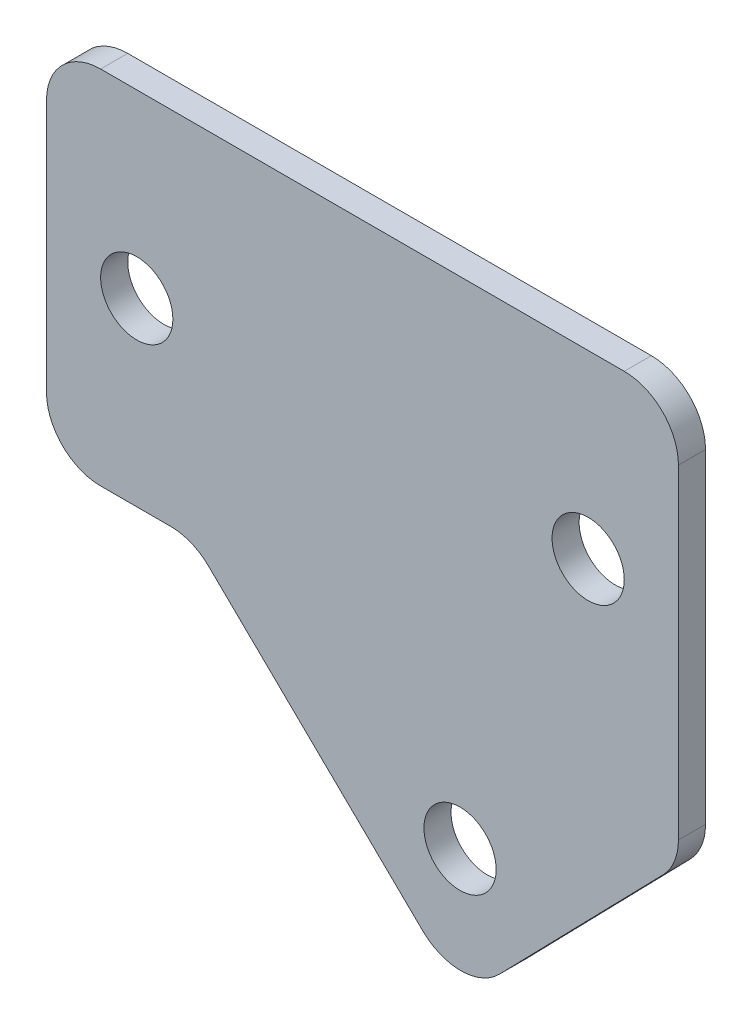
from build123d import *

# Parameters (mm, degrees)
SKETCH_1_R      = 2
EXTRUDE_1_DEPTH = 1.5
FILLET_1_R      = 3


with BuildPart() as part:
    # ｽｹｯﾁ1 → ﾎﾞｽ - 押し出し1 (new body)
    # profile 1 of 2: a face of its own
    with BuildSketch(Plane.XY):
        Polygon((-9.402488121, -2.740817625), (5.495827016, -17.259182375), (17.5, -4.940856231), (17.5, 17.259182375), (-17.5, 17.259182375), (-17.5, 5.150184139), align=None)
        with Locations((5.404503628, -10.188704312)):
            Circle(SKETCH_1_R, mode=Mode.SUBTRACT)
        with Locations((-12.5, 7.259182375)):
            Circle(SKETCH_1_R, mode=Mode.SUBTRACT)
        with Locations((12.5, 7.259182375)):
            Circle(SKETCH_1_R, mode=Mode.SUBTRACT)
    # profile 2 of 2: a face of its own
    with BuildSketch(Plane.XY):
        Polygon((-17.5, 5.150184139), (-17.5, -2.740817625), (-9.402488121, -2.740817625), align=None)
    extrude(amount=EXTRUDE_1_DEPTH)

    # ﾌｨﾚｯﾄ1
    fillet_1_edges = [part.edges().sort_by_distance(p)[0] for p in [
        (-9.402488121, -2.740817625, 0.75),
        (-17.5, -2.740817625, 0.75),
        (-17.5, 17.259182375, 0.75),
        (17.5, 17.259182375, 0.75),
        (17.5, -4.940856231, 0.75),
        (5.495827016, -17.259182375, 0.75),
    ]]
    fillet(fillet_1_edges, radius=FILLET_1_R)


solid = part.part
